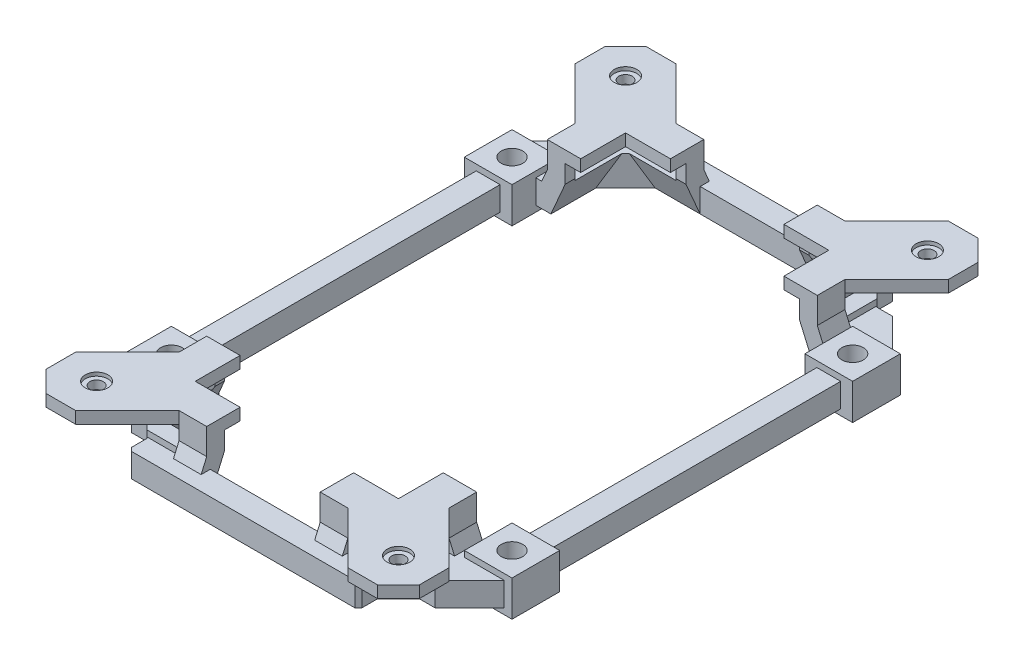
from build123d import *

# Parameters (mm, degrees)
BOSS_EXTRUDE1_DEPTH                        = 8
BOSS_EXTRUDE2_DEPTH                        = 2
BOSS_EXTRUDE3_DEPTH                        = 9.05
SKETCH4_R                                  = 2.25
BOSS_EXTRUDE4_DEPTH                        = 4
CUT_EXTRUDE1_REACH                         = 91.095
SKETCH5_W                                  = 24
SKETCH5_H                                  = 7
CUT_EXTRUDE1_DIRECTION_2_DEPTH             = 90.094705278
CUT_EXTRUDE2_DEPTH                         = 15.096447
CUT_EXTRUDE3_REACH                         = 121.197
SKETCH8_W                                  = 3.394112549
SKETCH8_H                                  = 10.05
CUT_EXTRUDE3_DIRECTION_2_REACH             = 121.197
BOSS_EXTRUDE5_DEPTH                        = 9.27944
SKETCH12_R                                 = 3.6
CUT_EXTRUDE5_DEPTH                         = 121.68810336
BOSS_EXTRUDE6_START                        = 2
SKETCH13_W                                 = 16
SKETCH13_H                                 = 16
SKETCH13_R                                 = 3.6
BOSS_EXTRUDE6_DEPTH                        = 2
CUT_EXTRUDE6_DEPTH                         = 8
MIRROR5_AT_THE_SECOND_PLANE_COPY_1_DEPTH   = 8
SKETCH20_R                                 = 3.8
CUT_EXTRUDE7_DEPTH                         = 1.2
MIRROR6_AT_THE_SECOND_PLANE_COPY_1_SKETC_R = 3.8
MIRROR6_AT_THE_SECOND_PLANE_COPY_1_DEPTH   = 1.2


with BuildPart() as part:
    # Sketch1 → Boss-Extrude1 (new body)
    with BuildSketch(Plane(origin=(0, 0, 0), x_dir=(1, 0, 0), z_dir=(0, 1, 0))):
        Polygon((-53.15, 0), (-61.15, 0), (-61.15, -49.15), (-65.15, -49.15), (-65.15, -65.15), (-62.510155108, -65.15), (-37.460155108, -90.2), (0, -90.2), (0, -82.2), (-19.05, -82.2), (-19.05, -77.4), (-36.546446609, -77.4), (-39.3, -74.646446609), (-39.3, -57.15), (-49.15, -57.15), (-49.15, -49.15), (-53.15, -49.15), align=None)
    extrude(amount=BOSS_EXTRUDE1_DEPTH)

    # Sketch2 → Boss-Extrude2 (add)
    with BuildSketch(Plane.XZ):
        Polygon((-49.15, 57.15), (-49.15, 49.15), (-65.15, 49.15), (-65.15, 65.15), (-49.15, 65.15), align=None)
    extrude(amount=BOSS_EXTRUDE2_DEPTH)

    # Sketch3 → Boss-Extrude3 (add)
    with BuildSketch(Plane(origin=(0, 8, 0), x_dir=(1, 0, 0), z_dir=(0, 1, 0))):
        Polygon((-39.3, -57.15), (-45.3, -57.15), (-45.3, -77.131727984), (-39.031727984, -83.4), (-19.05, -83.4), (-19.05, -77.4), (-36.546446609, -77.4), (-39.3, -74.646446609), align=None)
    extrude(amount=BOSS_EXTRUDE3_DEPTH)

    # Sketch4 → Boss-Extrude4 (add)
    with BuildSketch(Plane(origin=(0, 17.05, 0), x_dir=(1, 0, 0), z_dir=(0, 1, 0))):
        Polygon((-45.3, -57.15), (-34.1, -57.15), (-34.1, -72.2), (-19.05, -72.2), (-19.05, -83.4), (-28.329437252, -83.4), (-45.680582618, -100.751145366), (-55.621708115, -100.751145366), (-62.651145366, -93.721708115), (-62.651145366, -83.780582618), (-45.3, -66.429437252), align=None)
        with Locations(Location((-50.651145366, -88.751145366, 0), (0, 0, 270))):
            Circle(SKETCH4_R, mode=Mode.SUBTRACT)
    extrude(amount=BOSS_EXTRUDE4_DEPTH)

    # Sketch5 → Cut-Extrude1 (cut, up to next)
    with BuildSketch(Plane(origin=(-61.215863992, 0, 61.215863992), x_dir=(0.7071067811865475, 0, 0.7071067811865477), z_dir=(-0.7071067811865477, 0, 0.7071067811865475)), mode=Mode.PRIVATE) as cut_extrude1_sk1:
        with Locations((26.940768363, 13.55)):
            Rectangle(SKETCH5_W, SKETCH5_H)
    cut_extrude1_tool1 = extrude(cut_extrude1_sk1.sketch, amount=-CUT_EXTRUDE1_REACH, mode=Mode.PRIVATE) & part.part
    add(cut_extrude1_tool1.solids().sort_by_distance((-42.165864, 13.55, 80.265864))[0], mode=Mode.SUBTRACT)

    # Sketch5 → Cut-Extrude1 direction 2 (cut)
    with BuildSketch(Plane(origin=(-61.215863992, 0, 61.215863992), x_dir=(0.7071067811865475, 0, 0.7071067811865477), z_dir=(-0.7071067811865477, 0, 0.7071067811865475))):
        with Locations((26.940768363, 13.55)):
            Rectangle(SKETCH5_W, SKETCH5_H)
    extrude(amount=CUT_EXTRUDE1_DIRECTION_2_DEPTH, mode=Mode.SUBTRACT)

    # Sketch6 → Cut-Extrude2 (cut)
    with BuildSketch(Plane(origin=(-19.05, 0, 0), x_dir=(0, 0, -1), z_dir=(1, 0, 0))):
        Polygon((-82.2, 0), (-77.4, 11.05), (-77.4, 0), align=None)
    cut_extrude2 = extrude(amount=-CUT_EXTRUDE2_DEPTH, mode=Mode.SUBTRACT)

    # Mirror1: Cut-Extrude2 across plane
    add(cut_extrude2.mirror(Plane(origin=(19.05, 0, 19.05), x_dir=(-0.7071067811865477, 0, 0.7071067811865474), z_dir=(0.7071067811865476, 0, 0.7071067811865476))), mode=Mode.SUBTRACT)

    # Cut-Extrude3: up to this plane
    cut_extrude3_end = Plane(origin=(-44.1, 0, 72.246446609), z_dir=(0.9172019689893521, -0.39842257476460297, 0))
    # Sketch8 → Cut-Extrude3 (cut, up to the surface)
    with BuildSketch(Plane(origin=(19.05, 0, 19.05), x_dir=(0.7071067811865476, 0, -0.7071067811865476), z_dir=(0.7071067811865476, 0, 0.7071067811865476)), mode=Mode.PRIVATE) as cut_extrude3_sk1:
        with Locations((-80.57230509, 5.025)):
            Rectangle(SKETCH8_W, SKETCH8_H)
    cut_extrude3_tool1 = split(extrude(cut_extrude3_sk1.sketch, amount=-CUT_EXTRUDE3_REACH, mode=Mode.PRIVATE), bisect_by=cut_extrude3_end, keep=Keep.BOTH, mode=Mode.PRIVATE)
    add(cut_extrude3_tool1.solids().sort_by_distance((-37.923223, 5.025, 76.023223))[0], mode=Mode.SUBTRACT)

    # Cut-Extrude3 direction 2: up to this plane
    cut_extrude3_direction_2_end = Plane(origin=(-34.146446609, 0, 82.2), z_dir=(0, 0.39842257476460297, 0.9172019689893521))
    # Sketch8 → Cut-Extrude3 direction 2 (cut, up to the surface)
    with BuildSketch(Plane(origin=(19.05, 0, 19.05), x_dir=(0.7071067811865476, 0, -0.7071067811865476), z_dir=(0.7071067811865476, 0, 0.7071067811865476)), mode=Mode.PRIVATE) as cut_extrude3_direction_2_sk1:
        with Locations((-80.57230509, 5.025)):
            Rectangle(SKETCH8_W, SKETCH8_H)
    cut_extrude3_direction_2_tool1 = split(extrude(cut_extrude3_direction_2_sk1.sketch, amount=CUT_EXTRUDE3_DIRECTION_2_REACH, mode=Mode.PRIVATE), bisect_by=cut_extrude3_direction_2_end, keep=Keep.BOTH, mode=Mode.PRIVATE)
    add(cut_extrude3_direction_2_tool1.solids().sort_by_distance((-37.923223, 5.025, 76.023223))[0], mode=Mode.SUBTRACT)

    # Sketch10 → Boss-Extrude5 (add)
    with BuildSketch(Plane(origin=(-19.05, 0, 0), x_dir=(0, 0, -1), z_dir=(1, 0, 0))):
        Polygon((-83.4, 12.296887645), (-85.26652133, 8), (-83.4, 8), align=None)
    boss_extrude5 = extrude(amount=-BOSS_EXTRUDE5_DEPTH)

    # Mirror2: Boss-Extrude5 across plane
    add(boss_extrude5.mirror(Plane(origin=(19.05, 0, 19.05), x_dir=(-0.7071067811865477, 0, 0.7071067811865474), z_dir=(0.7071067811865476, 0, 0.7071067811865476))))

    # Sketch12 → Cut-Extrude5 (cut, through all)
    with BuildSketch(Plane(origin=(0, 8, 0), x_dir=(1, 0, 0), z_dir=(0, 1, 0))):
        with Locations(Location((-57.15, -57.15, 0), (0, 0, 270))):
            Circle(SKETCH12_R)
    extrude(amount=-CUT_EXTRUDE5_DEPTH, mode=Mode.SUBTRACT)

    # Mirror3: part across plane


with BuildPart() as part_1:
    add(part.part)
    add(part.part.mirror(Plane(origin=(-53.15, 8, 0), x_dir=(1, 0, 0), z_dir=(0, 0, 1))))

    # Mirror4: part across plane


with BuildPart() as part_2:
    add(part_1.part)
    add(part_1.part.mirror(Plane(origin=(0, 8, -90.2), x_dir=(0, 0, 1), z_dir=(-1, 0, 0))))

    # Sketch13 → Boss-Extrude6 (add)
    # profile 1 of 4: a face of its own
    with BuildSketch(Plane(origin=(0, 8, 0), x_dir=(1, 0, 0), z_dir=(0, 1, 0)).offset(BOSS_EXTRUDE6_START)):
        with Locations((-57.15, 57.15)):
            Rectangle(SKETCH13_W, SKETCH13_H)
        with Locations(Location((-57.15, 57.15, 0), (0, 0, 90))):
            Circle(SKETCH13_R, mode=Mode.SUBTRACT)
    # profile 2 of 4: a face of its own
    with BuildSketch(Plane(origin=(0, 8, 0), x_dir=(1, 0, 0), z_dir=(0, 1, 0)).offset(BOSS_EXTRUDE6_START)):
        with Locations((-57.15, -57.15)):
            Rectangle(SKETCH13_W, SKETCH13_H)
        with Locations(Location((-57.15, -57.15, 0), (0, 0, 270))):
            Circle(SKETCH13_R, mode=Mode.SUBTRACT)
    # profile 3 of 4: a face of its own
    with BuildSketch(Plane(origin=(0, 8, 0), x_dir=(1, 0, 0), z_dir=(0, 1, 0)).offset(BOSS_EXTRUDE6_START)):
        with Locations((57.15, -57.15)):
            Rectangle(SKETCH13_W, SKETCH13_H)
        with Locations(Location((57.15, -57.15, 0), (0, 0, 270))):
            Circle(SKETCH13_R, mode=Mode.SUBTRACT)
    # profile 4 of 4: a face of its own
    with BuildSketch(Plane(origin=(0, 8, 0), x_dir=(1, 0, 0), z_dir=(0, 1, 0)).offset(BOSS_EXTRUDE6_START)):
        with Locations((57.15, 57.15)):
            Rectangle(SKETCH13_W, SKETCH13_H)
        with Locations(Location((57.15, 57.15, 0), (0, 0, 90))):
            Circle(SKETCH13_R, mode=Mode.SUBTRACT)
    extrude(amount=-BOSS_EXTRUDE6_DEPTH)

    # Sketch19 → Cut-Extrude6 (cut)
    with BuildSketch(Plane.XZ):
        Polygon((38.651145366, 83.780582618), (45.680582618, 76.751145366), (55.621708115, 76.751145366), (38.651145366, 93.721708115), align=None)
    cut_extrude6 = extrude(amount=-CUT_EXTRUDE6_DEPTH, mode=Mode.SUBTRACT)

    # Mirror5: Cut-Extrude6 across plane
    add(cut_extrude6.mirror(Plane(origin=(0, 0, 0), x_dir=(0, 0, 1), z_dir=(1, 0, 0))), mode=Mode.SUBTRACT)

    # Mirror5 at the second plane: Cut-Extrude6 across plane
    add(cut_extrude6.mirror(Plane.XY), mode=Mode.SUBTRACT)

    # Mirror5 at the second plane copy 1 sketc → Mirror5 at the second plane copy 1 (cut)
    with BuildSketch(Plane(origin=(0, 0, 0), x_dir=(-1, 0, 0), z_dir=(0, -1, 0))):
        Polygon((38.651145366, 83.780582618), (45.680582618, 76.751145366), (55.621708115, 76.751145366), (38.651145366, 93.721708115), align=None)
    extrude(amount=-MIRROR5_AT_THE_SECOND_PLANE_COPY_1_DEPTH, mode=Mode.SUBTRACT)

    # Sketch20 → Cut-Extrude7 (cut)
    with BuildSketch(Plane(origin=(0, 21.05, 0), x_dir=(1, 0, 0), z_dir=(0, 1, 0))):
        with Locations(Location((-50.651145366, 88.751145366, 0), (0, 0, 270))):
            Circle(SKETCH20_R)
    cut_extrude7 = extrude(amount=-CUT_EXTRUDE7_DEPTH, mode=Mode.SUBTRACT)

    # Mirror6: Cut-Extrude7 across plane
    add(cut_extrude7.mirror(Plane.XY), mode=Mode.SUBTRACT)

    # Mirror6 at the second plane: Cut-Extrude7 across plane
    add(cut_extrude7.mirror(Plane(origin=(0, 0, 0), x_dir=(0, 0, 1), z_dir=(1, 0, 0))), mode=Mode.SUBTRACT)

    # Mirror6 at the second plane copy 1 sketc → Mirror6 at the second plane copy 1 (cut)
    with BuildSketch(Plane(origin=(0, 21.05, 0), x_dir=(-1, 0, 0), z_dir=(0, 1, 0))):
        with Locations(Location((-50.651145366, 88.751145366, 0), (0, 0, 270))):
            Circle(MIRROR6_AT_THE_SECOND_PLANE_COPY_1_SKETC_R)
    extrude(amount=-MIRROR6_AT_THE_SECOND_PLANE_COPY_1_DEPTH, mode=Mode.SUBTRACT)


solid = part_2.part
